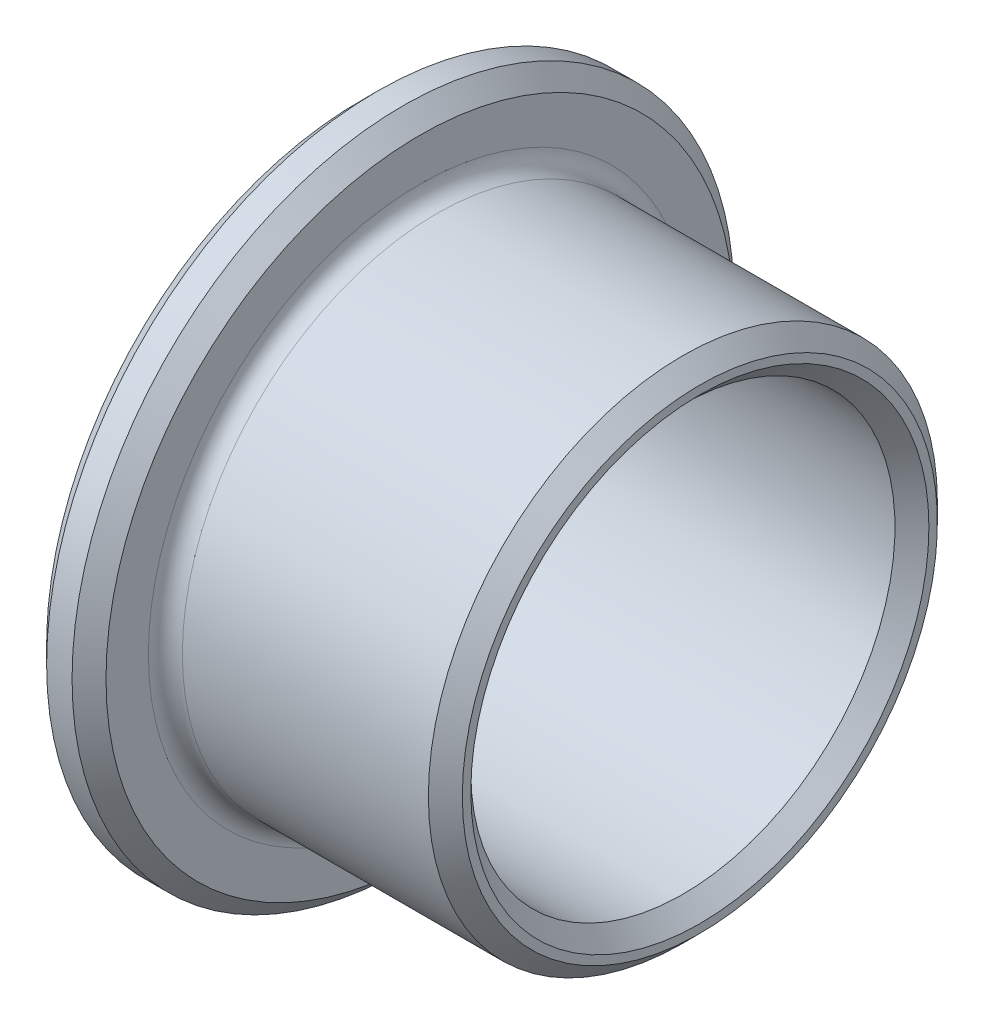
from build123d import *

# Parameters (mm, degrees)
CHAMFER1_SIZE = 1
FILLET1_R     = 1


with BuildPart() as part:
    # Sketch1 → Revolve1 (revolve)
    with BuildSketch(Plane.XY, mode=Mode.PRIVATE) as revolve1_sk:
        Polygon((0, 12.5), (20, 12.5), (20, 15), (3.5, 15), (3.5, 19.5), (0, 19.5), align=None)
    revolve(revolve1_sk.sketch.rotate(Axis((0, 0, 0), (1, 0, 0)), 90), axis=Axis((0, 0, 0), (1, 0, 0)))

    # Chamfer1
    chamfer1_edges = [part.edges().sort_by_distance(p)[0] for p in [
        (0, 0, -19.5),
        (3.5, 0, -19.5),
        (20, 0, -15),
        (20, 0, -12.5),
        (0, 0, -12.5),
    ]]
    chamfer(chamfer1_edges, length=CHAMFER1_SIZE)

    # Fillet1
    fillet1_edges = [part.edges().sort_by_distance(p)[0] for p in [
        (3.5, 0, -15),
    ]]
    fillet(fillet1_edges, radius=FILLET1_R)


solid = part.part
